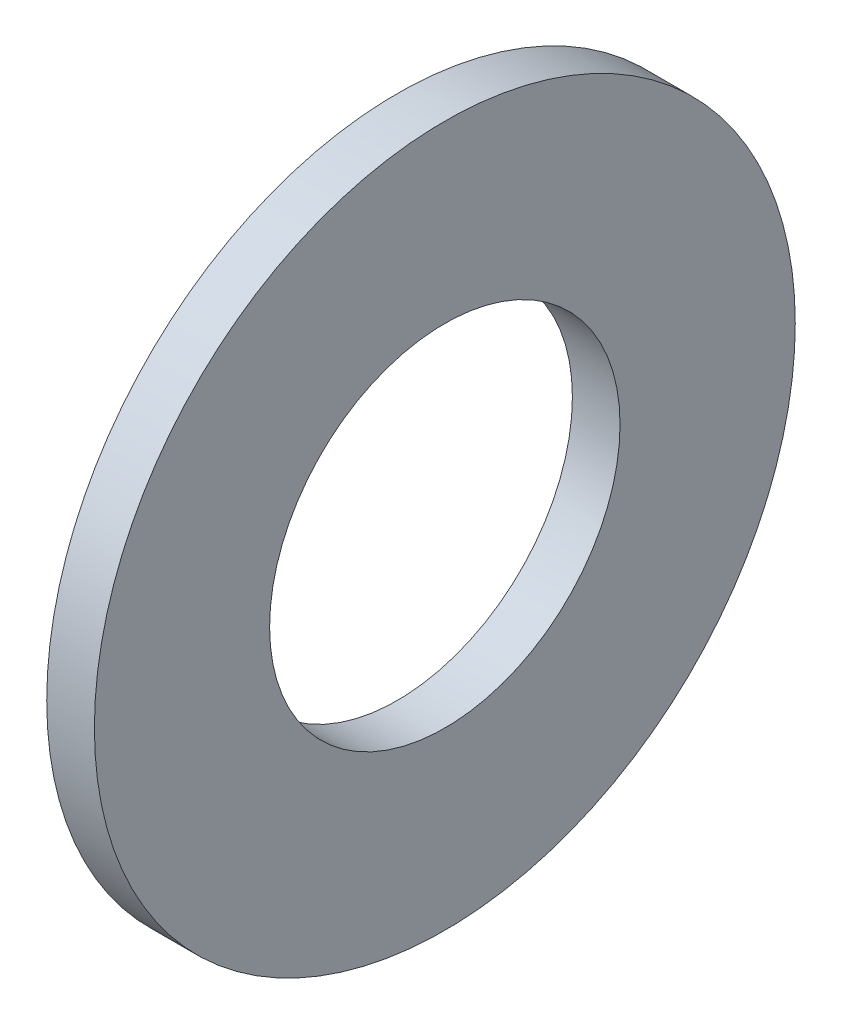
from build123d import *

# Parameters (mm, degrees)
SKETCH1_R           = 6.35
SKETCH1_R_2         = 3.175
BOSS_EXTRUDE1_DEPTH = 0.8636


with BuildPart() as part:
    # Sketch1 → Boss-Extrude1 (new body)
    with BuildSketch(Plane(origin=(0, 0, 0), x_dir=(0, 0, -1), z_dir=(1, 0, 0))):
        Circle(SKETCH1_R)
        Circle(SKETCH1_R_2, mode=Mode.SUBTRACT)
    extrude(amount=BOSS_EXTRUDE1_DEPTH)


solid = part.part
